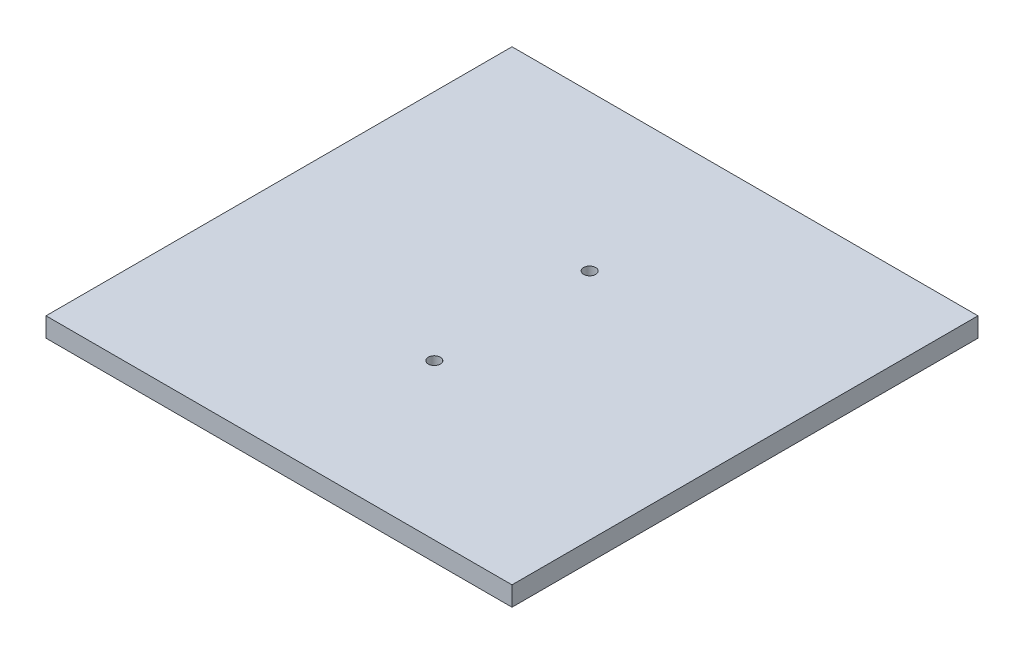
from build123d import *

# Parameters (mm, degrees)
SCHIZZO1_W                   = 120
SCHIZZO1_H                   = 120
ESTRUSIONE_ESTRUSIONE1_DEPTH = 5
FORO_PER_VITE_M2_5_1_D       = 3.1


with BuildPart() as part:
    # Schizzo1 → Estrusione-Estrusione1 (new body)
    with BuildSketch(Plane(origin=(0, 0, 0), x_dir=(1, 0, 0), z_dir=(0, 1, 0))):
        with Locations((12.320185615, 19.767981439)):
            Rectangle(SCHIZZO1_W, SCHIZZO1_H)
    extrude(amount=ESTRUSIONE_ESTRUSIONE1_DEPTH)

    # Foro per Vite M2.5-1 (through all)
    with Locations(Plane(origin=(12.320185615, 0, 0.232018561), x_dir=(0, 0, -1), z_dir=(0, -1, 0))):
        with Locations((0, 0), (40, 0)):
            Hole(FORO_PER_VITE_M2_5_1_D / 2)


solid = part.part
